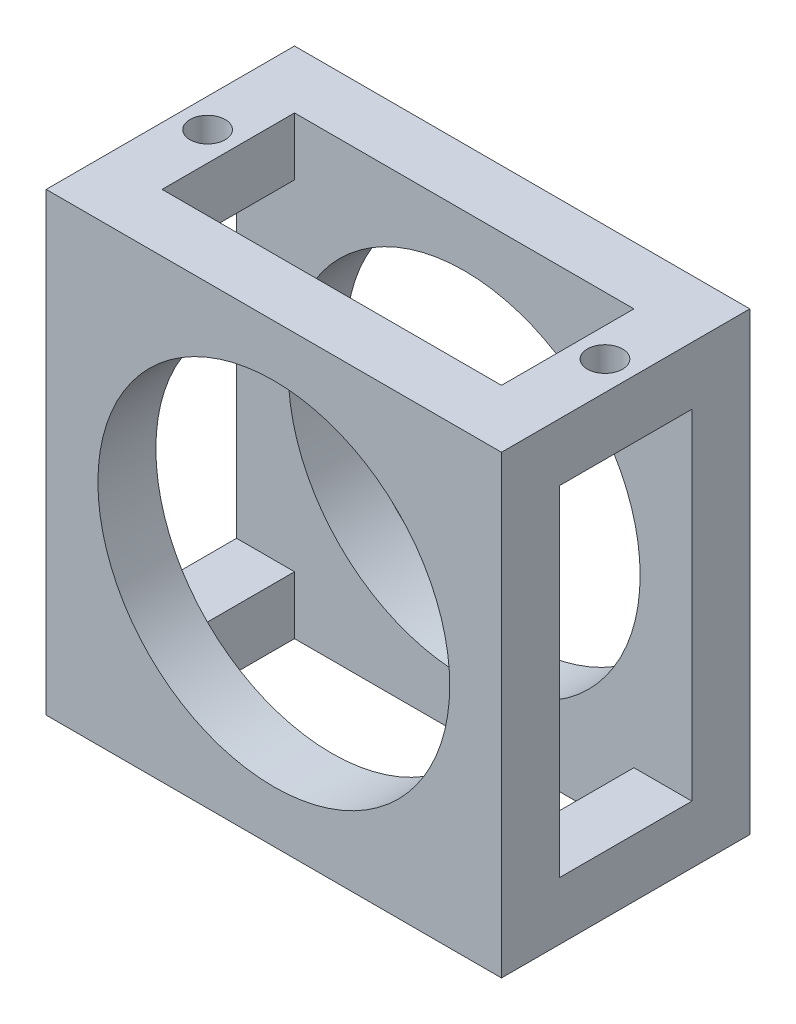
from build123d import *

# Parameters (mm, degrees)
SKETCH1_W           = 55
SKETCH1_H           = 55
BOSS_EXTRUDE1_DEPTH = 30
SKETCH2_R           = 21.25
CUT_EXTRUDE1_DEPTH  = 30
SKETCH3_W           = 41
SKETCH3_H           = 16
CUT_EXTRUDE2_DEPTH  = 60
SKETCH4_W           = 16
SKETCH4_H           = 41
CUT_EXTRUDE3_DEPTH  = 60
SKETCH5_R           = 2.125
CUT_EXTRUDE4_DEPTH  = 10


with BuildPart() as part:
    # Sketch1 → Boss-Extrude1 (new body)
    with BuildSketch(Plane.XY):
        Rectangle(SKETCH1_W, SKETCH1_H)
    extrude(amount=BOSS_EXTRUDE1_DEPTH)

    # Sketch2 → Cut-Extrude1 (cut)
    with BuildSketch(Plane.XY.offset(30)):
        Circle(SKETCH2_R)
    extrude(amount=-CUT_EXTRUDE1_DEPTH, mode=Mode.SUBTRACT)

    # Sketch3 → Cut-Extrude2 (cut)
    with BuildSketch(Plane(origin=(0, 27.5, 0), x_dir=(1, 0, 0), z_dir=(0, 1, 0))):
        with Locations((0, -15)):
            Rectangle(SKETCH3_W, SKETCH3_H)
    extrude(amount=-CUT_EXTRUDE2_DEPTH, mode=Mode.SUBTRACT)

    # Sketch4 → Cut-Extrude3 (cut)
    with BuildSketch(Plane(origin=(27.5, 0, 0), x_dir=(0, 0, -1), z_dir=(1, 0, 0))):
        with Locations((-15, 0)):
            Rectangle(SKETCH4_W, SKETCH4_H)
    extrude(amount=-CUT_EXTRUDE3_DEPTH, mode=Mode.SUBTRACT)

    # Sketch5 → Cut-Extrude4 (cut)
    with BuildSketch(Plane(origin=(0, 27.5, 0), x_dir=(1, 0, 0), z_dir=(0, 1, 0))):
        with Locations(Location((-24, -14, 0), (0, 0, 270))):
            Circle(SKETCH5_R)
        with Locations(Location((24, -14, 0), (0, 0, 270))):
            Circle(SKETCH5_R)
    extrude(amount=-CUT_EXTRUDE4_DEPTH, mode=Mode.SUBTRACT)


solid = part.part
